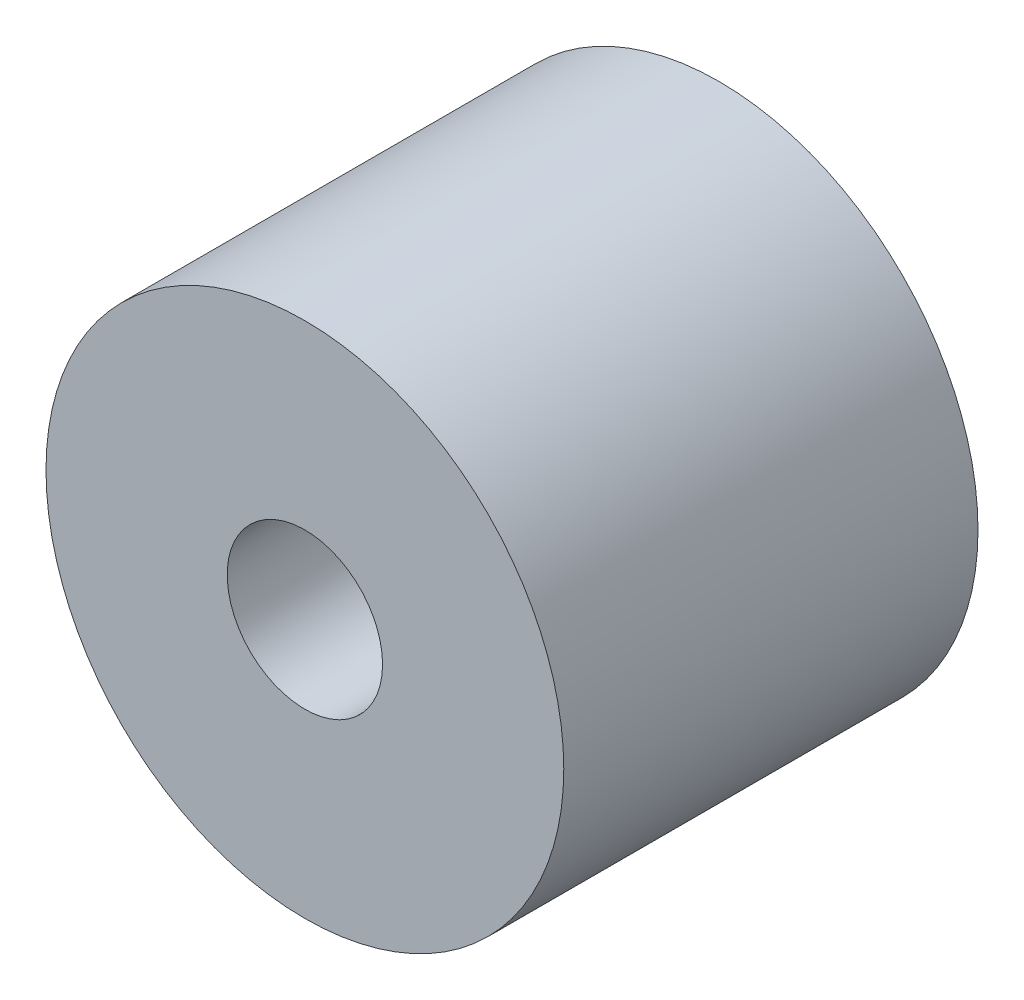
from build123d import *

# Parameters (mm, degrees)
SKETCH1_R           = 5
SKETCH1_R_2         = 1.5
BOSS_EXTRUDE1_DEPTH = 8


with BuildPart() as part:
    # Sketch1 → Boss-Extrude1 (new body)
    with BuildSketch(Plane.XY):
        with Locations((-51.392941983, 26.066204387)):
            Circle(SKETCH1_R)
        with Locations((-51.392941983, 26.066204387)):
            Circle(SKETCH1_R_2, mode=Mode.SUBTRACT)
    extrude(amount=BOSS_EXTRUDE1_DEPTH)


solid = part.part
